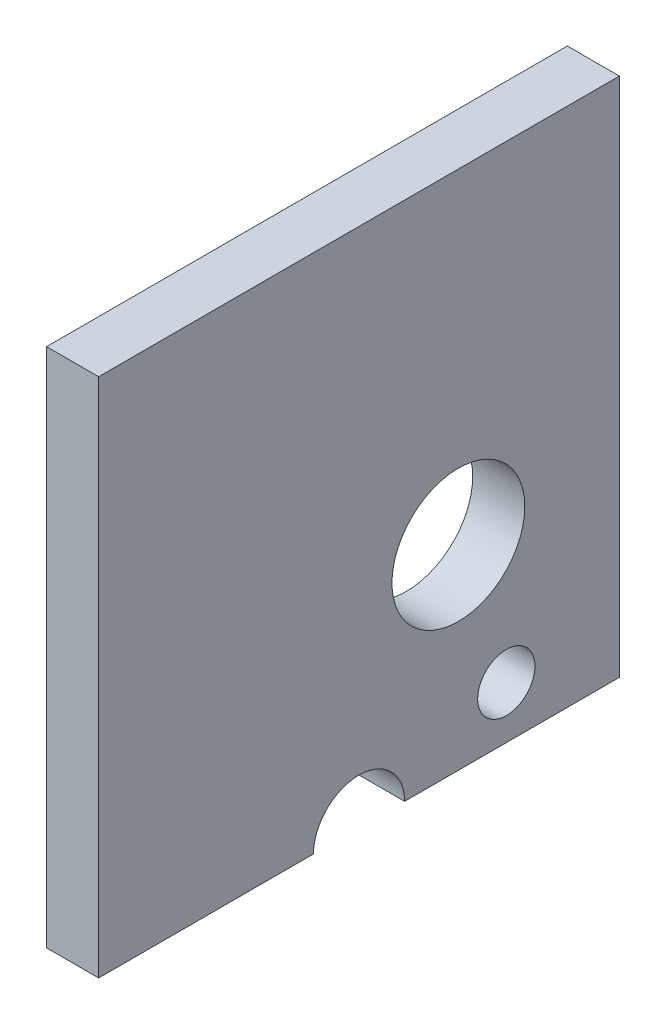
from build123d import *

# Parameters (mm, degrees)
EXTRUDE_1_DEPTH     = 2
SKETCH_2_R          = 1.1
SKETCH_2_R_2        = 2.55
CUT_EXTRUDE_1_DEPTH = 29.354893758


with BuildPart() as part:
    # 草图1 → 凸台-拉伸1 (new body)
    with BuildSketch(Plane(origin=(0, 0, 0), x_dir=(0, 0, -1), z_dir=(1, 0, 0))):
        with BuildLine():
            Line((20, 0), (0, 0))
            Line((0, 0), (0, -20))
            Line((0, -20), (8.25, -20))
            ThreePointArc((8.25, -20), (10, -18.25), (11.75, -20))
            Line((11.75, -20), (20, -20))
            Line((20, -20), (20, 0))
        make_face()
    extrude(amount=EXTRUDE_1_DEPTH)

    # 草图2 → 切除-拉伸1 (cut, through all)
    with BuildSketch(Plane(origin=(2, 0, 0), x_dir=(0, 0, -1), z_dir=(1, 0, 0))):
        with Locations((15.656854249, -18)):
            Circle(SKETCH_2_R)
        with Locations((13.815658986, -12.5)):
            Circle(SKETCH_2_R_2)
    extrude(amount=-CUT_EXTRUDE_1_DEPTH, mode=Mode.SUBTRACT)


solid = part.part
